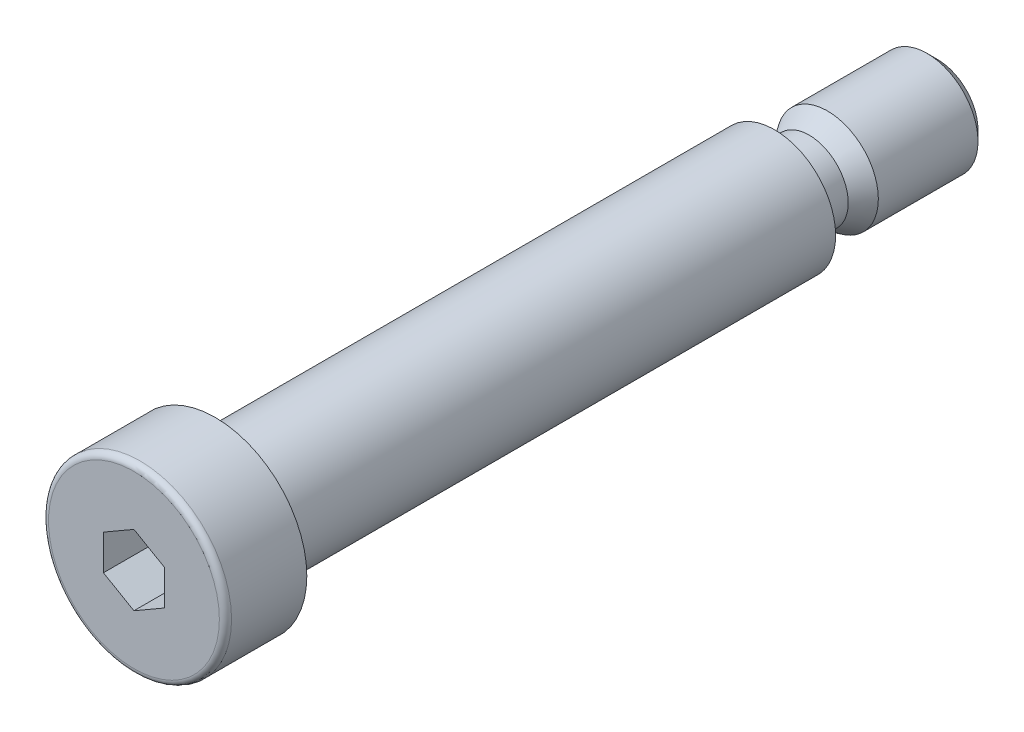
from build123d import *

# Parameters (mm, degrees)
SZKIC1_W                   = 3.85
SZKIC1_H                   = 3.39
WYTNIJ_WYCI_GNI_CIE1_DEPTH = 4.9
ZAOKR_GLENIE1_R            = 0.6


with BuildPart() as part:
    # Szkic1 → Obrót1 (revolve)
    with BuildSketch(Plane(origin=(0, 0, 0), x_dir=(1, 0, 0), z_dir=(0, 1, 0)), mode=Mode.PRIVATE) as obr_t1_sk:
        Polygon((0, -35.5), (0, -27.5), (-6, -27.5), (-9, -27.5), (-9, -35.5), align=None)
        Polygon((0, -27.5), (0, 27.5), (-3.85, 27.5), (-6, 27.5), (-6, -27.5), align=None)
        with Locations((-1.925, 29.195)):
            Rectangle(SZKIC1_W, SZKIC1_H)
        Polygon((-3.85, 30.89), (0, 30.89), (0, 43.5), (-4, 43.5), (-5, 42.5), (-5, 32.7), align=None)
    revolve(obr_t1_sk.sketch.rotate(Axis((0, 0, 35.5), (0, 0, -1)), 180), axis=Axis((0, 0, 35.5), (0, 0, -1)))

    # Szkic2 → Wytnij-wyciągnięcie1 (cut)
    with BuildSketch(Plane.XY.offset(35.5)):
        Polygon((3, 1.732050808), (0, 3.464101615), (-3, 1.732050808), (-3, -1.732050808), (0, -3.464101615), (3, -1.732050808), align=None)
    extrude(amount=-WYTNIJ_WYCI_GNI_CIE1_DEPTH, mode=Mode.SUBTRACT)

    # Zaokrąglenie1
    zaokr_glenie1_edges = [part.edges().sort_by_distance(p)[0] for p in [
        (-9, 0, 35.5),
    ]]
    fillet(zaokr_glenie1_edges, radius=ZAOKR_GLENIE1_R)


solid = part.part
